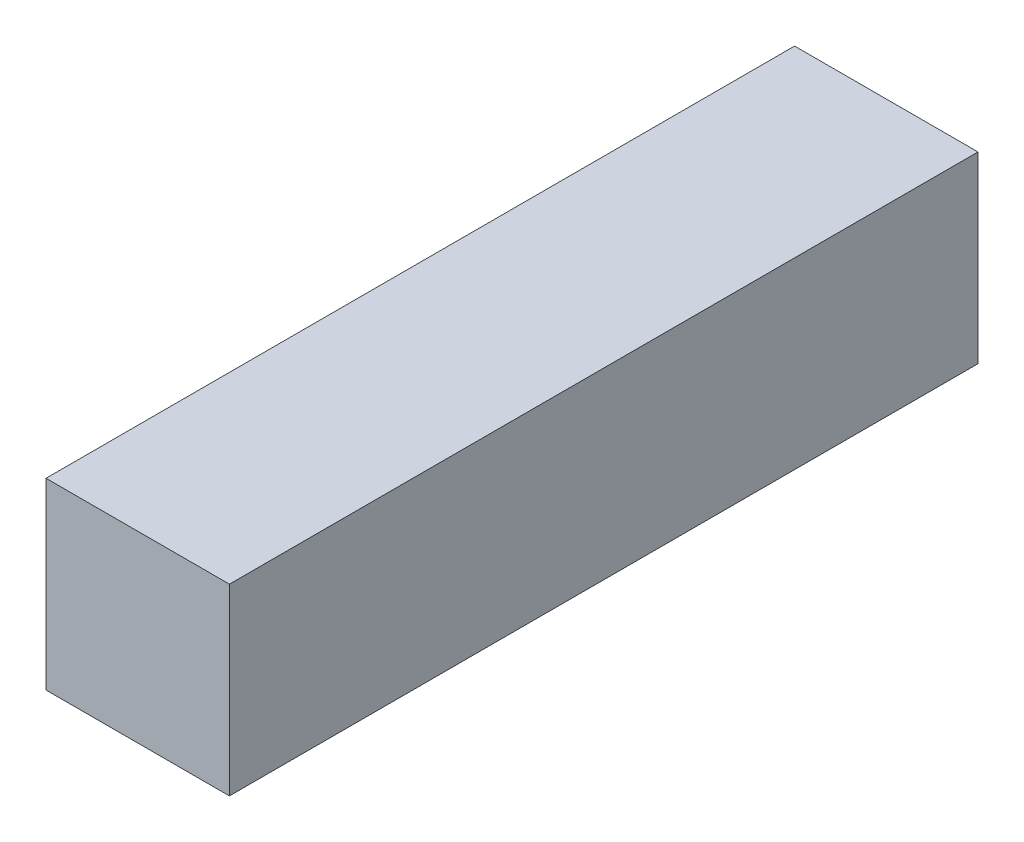
from build123d import *

# Parameters (mm, degrees)
SKETCH1_W           = 4.9
SKETCH1_H           = 4.9
BOSS_EXTRUDE1_DEPTH = 20


with BuildPart() as part:
    # Sketch1 → Boss-Extrude1 (new body)
    with BuildSketch(Plane.XY):
        Rectangle(SKETCH1_W, SKETCH1_H)
    extrude(amount=BOSS_EXTRUDE1_DEPTH)


solid = part.part
